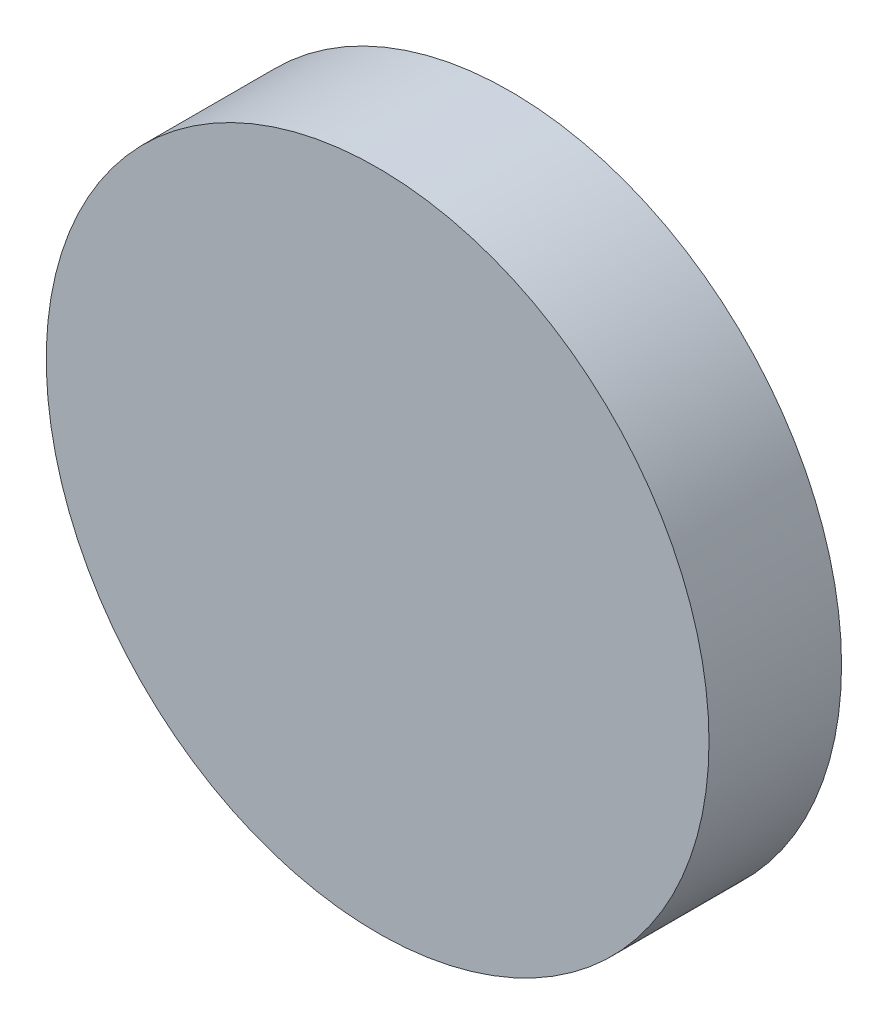
from build123d import *

# Parameters (mm, degrees)
SKETCH1_R           = 12.7
BOSS_EXTRUDE1_DEPTH = 5.08


with BuildPart() as part:
    # Sketch1 → Boss-Extrude1 (new body)
    with BuildSketch(Plane.XY):
        Circle(SKETCH1_R)
    extrude(amount=BOSS_EXTRUDE1_DEPTH)


solid = part.part
